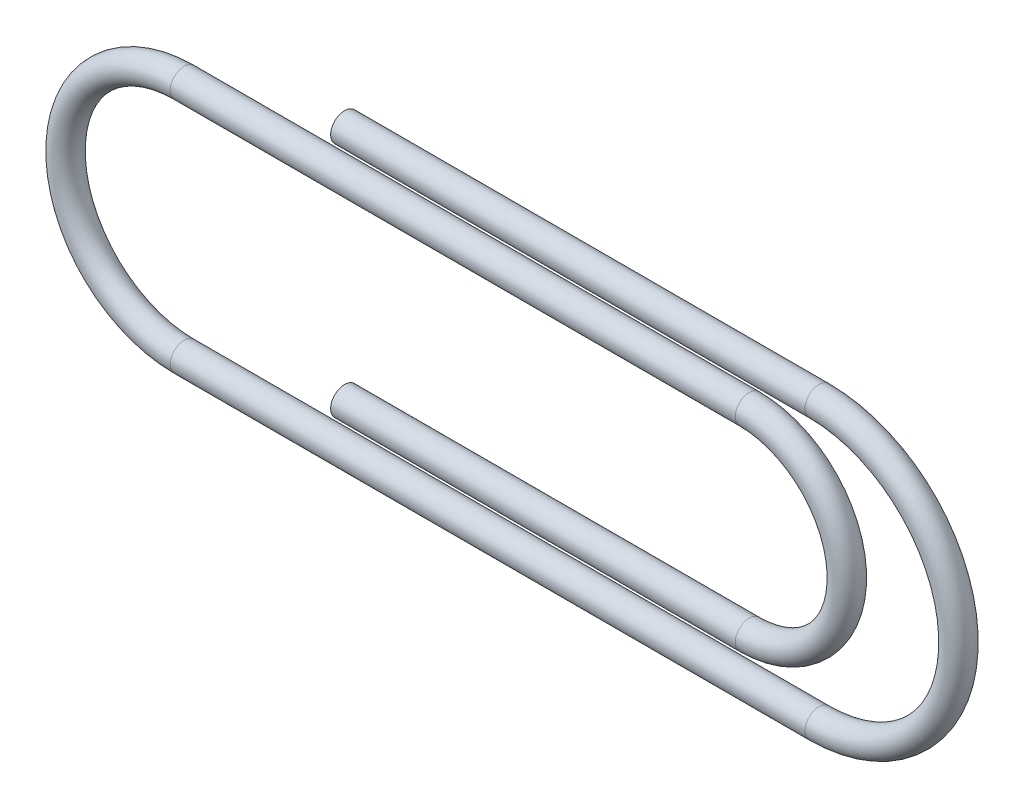
from build123d import *

# Parameters (mm, degrees)
SKETCH7_R = 0.5


with BuildPart() as part:
    # Sweep1: sweep along a path in Sketch1
    with BuildLine(Plane.XY) as sweep1_path:
        Line((0, 0), (14.5, 0))
        ThreePointArc((14.5, 0), (18, 3.5), (14.5, 7))
        Line((14.5, 7), (-5.75, 7))
        ThreePointArc((-5.75, 7), (-10, 2.75), (-5.75, -1.5))
        Line((-5.75, -1.5), (17, -1.5))
        ThreePointArc((17, -1.5), (22, 3.5), (17, 8.5))
        Line((17, 8.5), (0, 8.5))
    # Sketch7 → Sweep1 (sweep)
    with BuildSketch(Plane(origin=(0, 0, 0), x_dir=(0, 0, -1), z_dir=(1, 0, 0))):
        Circle(SKETCH7_R)
    sweep(path=sweep1_path.line)


solid = part.part
